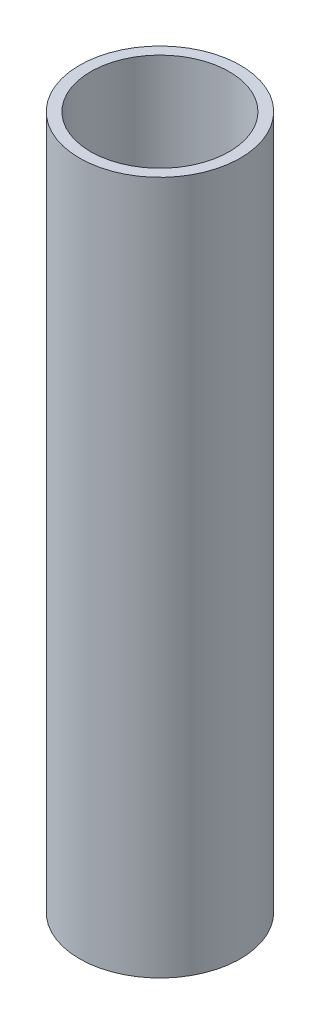
from build123d import *

# Parameters (mm, degrees)
SKETCH2_R           = 7.366
SKETCH2_R_2         = 6.35
BOSS_EXTRUDE1_DEPTH = 63.5


with BuildPart() as part:
    # Sketch2 → Boss-Extrude1 (new body)
    with BuildSketch(Plane(origin=(0, 0, 0), x_dir=(1, 0, 0), z_dir=(0, 1, 0))):
        with Locations(Location((0, 0, 0), (0, 0, 270))):
            Circle(SKETCH2_R)
        with Locations(Location((0, 0, 0), (0, 0, 270))):
            Circle(SKETCH2_R_2, mode=Mode.SUBTRACT)
    extrude(amount=BOSS_EXTRUDE1_DEPTH)


solid = part.part
